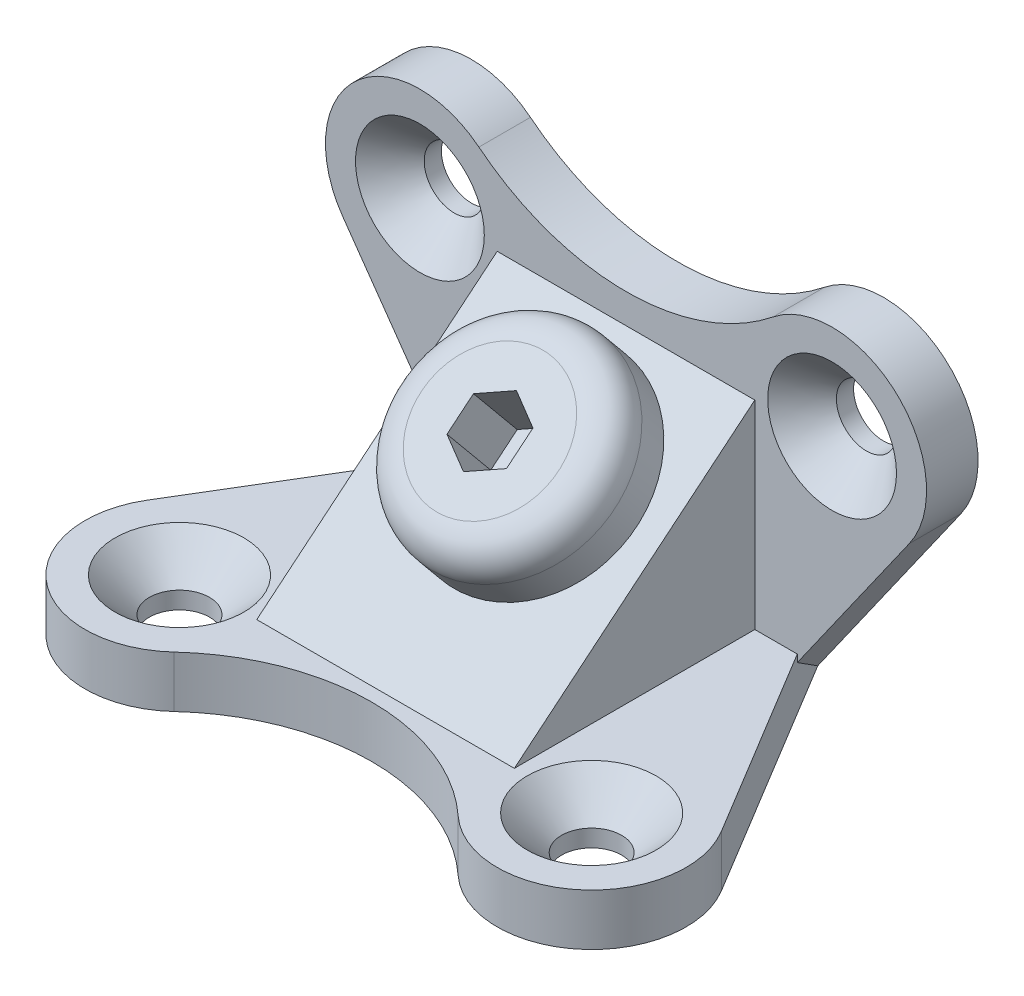
from build123d import *

# Parameters (mm, degrees)
SKETCH_1_R      = 1.75
EXTRUDE_1_DEPTH = 3
SKETCH_2_R      = 1.75
EXTRUDE_2_DEPTH = 3
EXTRUDE_3_DEPTH = 7.5
SKETCH_4_R      = 6
EXTRUDE_4_DEPTH = 4
FILLET_1_R      = 2
CHAMFER_1_SIZE  = 2


with BuildPart() as part:
    # 草图1 → 凸台-拉伸1 (new body)
    with BuildSketch(Plane.XY):
        with BuildLine():
            Line((8.162825685, 0), (-8.162825685, 0))
            Line((-8.162825685, 0), (-16.496696216, 11.833026185))
            ThreePointArc((-16.496696216, 11.833026185), (-15.768394863, 19.006145299), (-8.564177238, 19.294778452))
            ThreePointArc((-8.564177238, 19.294778452), (0, 16.290627288), (8.564177238, 19.294778452))
            ThreePointArc((8.564177238, 19.294778452), (15.768394863, 19.006145299), (16.496696216, 11.833026185))
            Line((16.496696216, 11.833026185), (8.162825685, 0))
        make_face()
        with Locations((-12, 15)):
            Circle(SKETCH_1_R, mode=Mode.SUBTRACT)
        with Locations(Location((12, 15, 0), (0, 0, 180))):
            Circle(SKETCH_1_R, mode=Mode.SUBTRACT)
    extrude(amount=EXTRUDE_1_DEPTH)

    # 草图2 → 凸台-拉伸2 (add)
    with BuildSketch(Plane.XZ):
        with BuildLine():
            Line((8.162825685, 0), (-8.162825685, 0))
            Line((-8.162825685, 0), (-16.708682104, 14.157762704))
            ThreePointArc((-16.708682104, 14.157762704), (-15.476402024, 21.261998237), (-8.269459435, 21.041418945))
            ThreePointArc((-8.269459435, 21.041418945), (0, 17.808193987), (8.269459435, 21.041418945))
            ThreePointArc((8.269459435, 21.041418945), (15.476402024, 21.261998237), (16.708682104, 14.157762704))
            Line((16.708682104, 14.157762704), (8.162825685, 0))
        make_face()
        with Locations(Location((-12, 17, 0), (0, 0, 270))):
            Circle(SKETCH_2_R, mode=Mode.SUBTRACT)
        with Locations(Location((12, 17, 0), (0, 0, 90))):
            Circle(SKETCH_2_R, mode=Mode.SUBTRACT)
    extrude(amount=-EXTRUDE_2_DEPTH)

    # 草图3 → 凸台-拉伸3 (add, symmetric)
    with BuildSketch(Plane(origin=(0, 0, 0), x_dir=(0, 0, -1), z_dir=(1, 0, 0))):
        Polygon((-3, 3), (-17, 3), (-3, 14.571172971), align=None)
    extrude(amount=EXTRUDE_3_DEPTH, both=True)

    # 草图4 → 凸台-拉伸4 (add)
    with BuildSketch(Plane(origin=(0, 10.130402441, 8.372902779), x_dir=(1, 0, 0), z_dir=(0, 0.7708007256408878, 0.6370763230190564))):
        with Locations(Location((0, 0, 0), (0, 0, 90))):
            Circle(SKETCH_4_R)
        Polygon((0, 2), (-1.732050808, 1), (-1.732050808, -1), (0, -2), (1.732050808, -1), (1.732050808, 1), align=None, mode=Mode.SUBTRACT)
    extrude(amount=EXTRUDE_4_DEPTH)

    # 圆角1
    fillet_1_edges = [part.edges().sort_by_distance(p)[0] for p in [
        (0, 9.391147406, 15.546012425),
    ]]
    fillet(fillet_1_edges, radius=FILLET_1_R)

    # 倒角1
    chamfer_1_edges = [part.edges().sort_by_distance(p)[0] for p in [
        (-13.75, 15, 3),
        (13.75, 15, 3),
        (12, 3, 15.25),
        (-12, 3, 18.75),
    ]]
    chamfer(chamfer_1_edges, length=CHAMFER_1_SIZE)


solid = part.part
